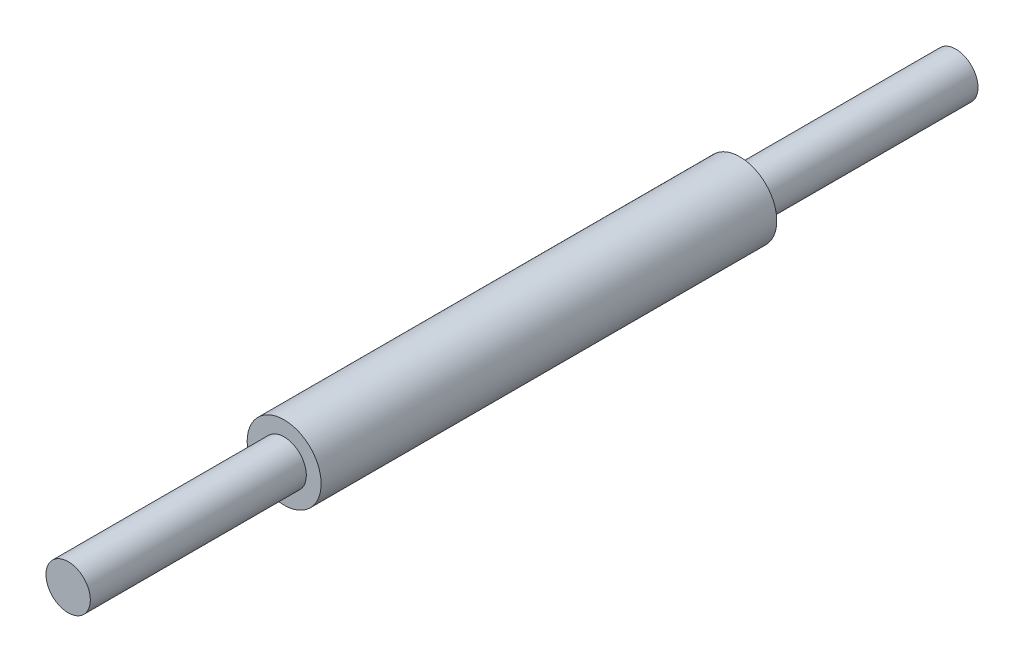
from build123d import *

# Parameters (mm, degrees)
SKETCH1_R           = 2.5
BOSS_EXTRUDE6_DEPTH = 15.4
SKETCH5_R           = 1.5
BOSS_EXTRUDE8_DEPTH = 30


with BuildPart() as part:
    # Sketch1 → Boss-Extrude6 (new, symmetric)
    with BuildSketch(Plane.XY):
        with Locations(Location((0, 0, 0), (0, 0, 180))):
            Circle(SKETCH1_R)
    extrude(amount=BOSS_EXTRUDE6_DEPTH, both=True)

    # Sketch5 → Boss-Extrude8 (add, symmetric)
    with BuildSketch(Plane.XY):
        Circle(SKETCH5_R)
    extrude(amount=BOSS_EXTRUDE8_DEPTH, both=True)


solid = part.part
